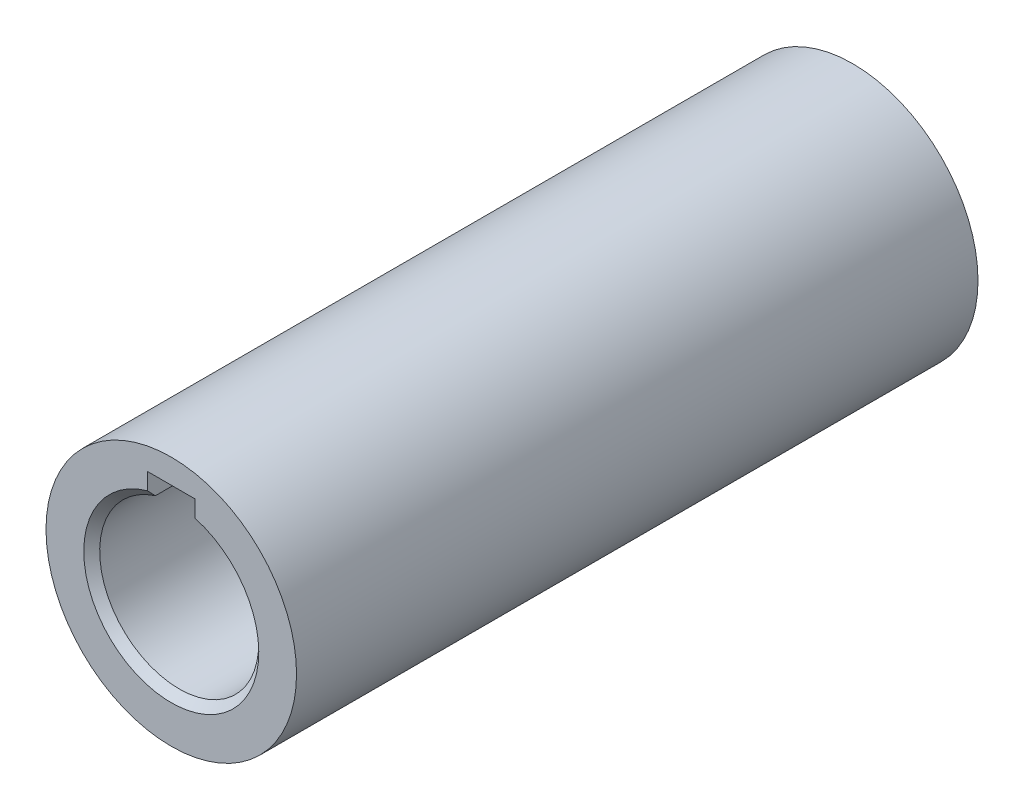
from build123d import *

# Parameters (mm, degrees)
BOSS_EXTRUDE1_DEPTH      = 34
BOSS_EXTRUDE1_DEPTH_BACK = 34
SKETCH2_R                = 12.5
KEYWAY_DEPTH             = 71.525832556
CHAMFER1_SIZE            = 0.79375


with BuildPart() as part:
    # Sketch2 → Boss-Extrude1 (new, two sides: drawn at the far end of the back side and taken through both)
    with BuildSketch(Plane.XY.offset(-BOSS_EXTRUDE1_DEPTH_BACK)):
        Circle(SKETCH2_R)
    extrude(amount=BOSS_EXTRUDE1_DEPTH + BOSS_EXTRUDE1_DEPTH_BACK)

    # KeySketch → Keyway (cut, through all)
    with BuildSketch(Plane(origin=(-0.021590267, -1.396144607, 34), x_dir=(1, 0, 0), z_dir=(0, 0, 1))):
        with BuildLine():
            Line((-2.359659733, 8.968037019), (-2.359659733, 11.467244607))
            Line((-2.359659733, 11.467244607), (2.402840267, 11.467244607))
            Line((2.402840267, 11.467244607), (2.402840267, 8.968037019))
            ThreePointArc((2.402840267, 8.968037019), (0.021590267, -6.541355393), (-2.359659733, 8.968037019))
        make_face()
    extrude(amount=-KEYWAY_DEPTH, mode=Mode.SUBTRACT)

    # Chamfer1
    chamfer1_edges = [part.edges().sort_by_distance(p)[0] for p in [
        (0, -7.9375, -34),
        (0, -7.9375, 34),
    ]]
    chamfer(chamfer1_edges, length=CHAMFER1_SIZE)


solid = part.part
